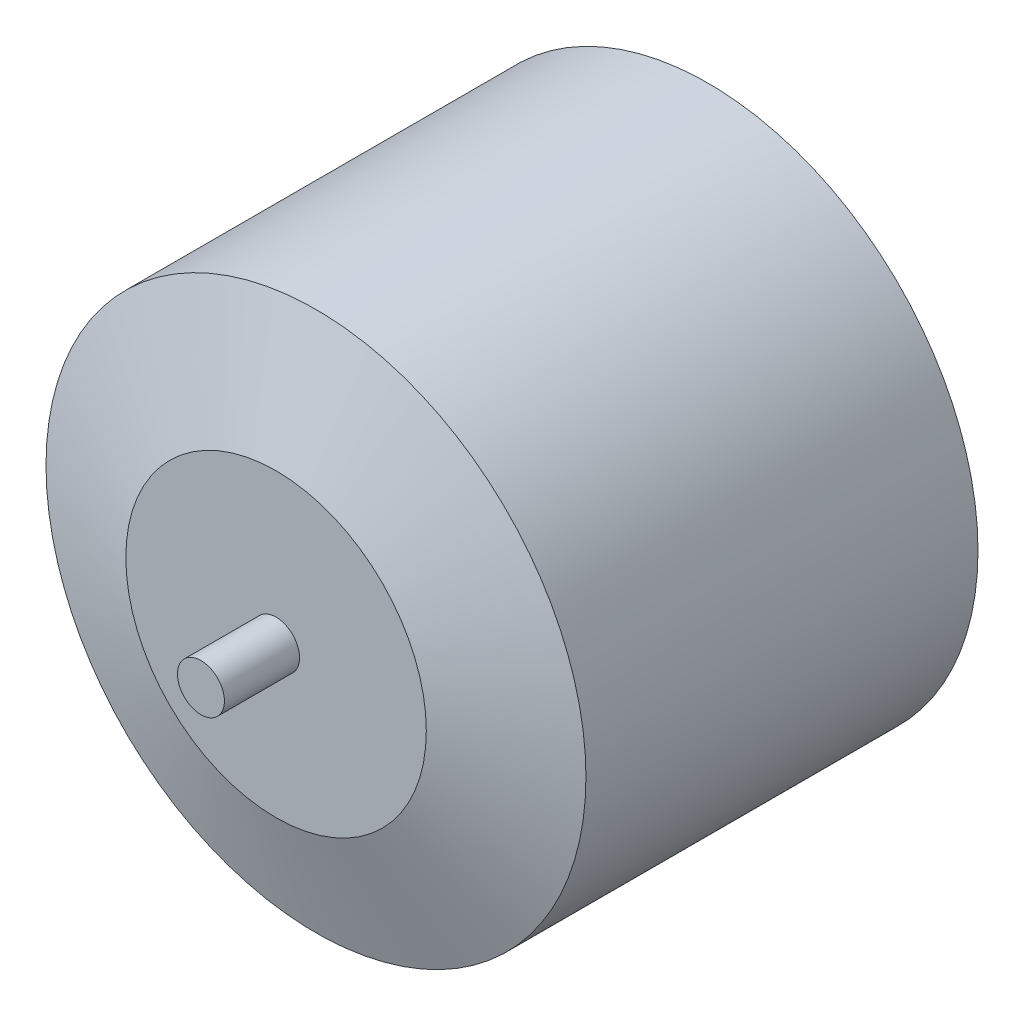
from build123d import *

# Parameters (mm, degrees)
SKETCH1_R           = 1
BOSS_EXTRUDE1_DEPTH = 3.2


with BuildPart() as part:
    # Sketch1 → Boss-Extrude1 (new body)
    with BuildSketch(Plane.XY):
        Circle(SKETCH1_R)
    extrude(amount=-BOSS_EXTRUDE1_DEPTH)

    # Sketch2 → Revolve1 (revolve)
    with BuildSketch(Plane(origin=(0, 0, 0), x_dir=(1, 0, 0), z_dir=(0, 1, 0)), mode=Mode.PRIVATE) as revolve1_sk:
        Polygon((0, 3.2), (0, 21.6), (-11.5, 21.6), (-11.5, 4.9), (-6.4, 3.2), align=None)
    revolve(revolve1_sk.sketch.rotate(Axis((0, 0, -3.2), (0, 0, -1)), 180), axis=Axis((0, 0, -3.2), (0, 0, -1)))


solid = part.part
